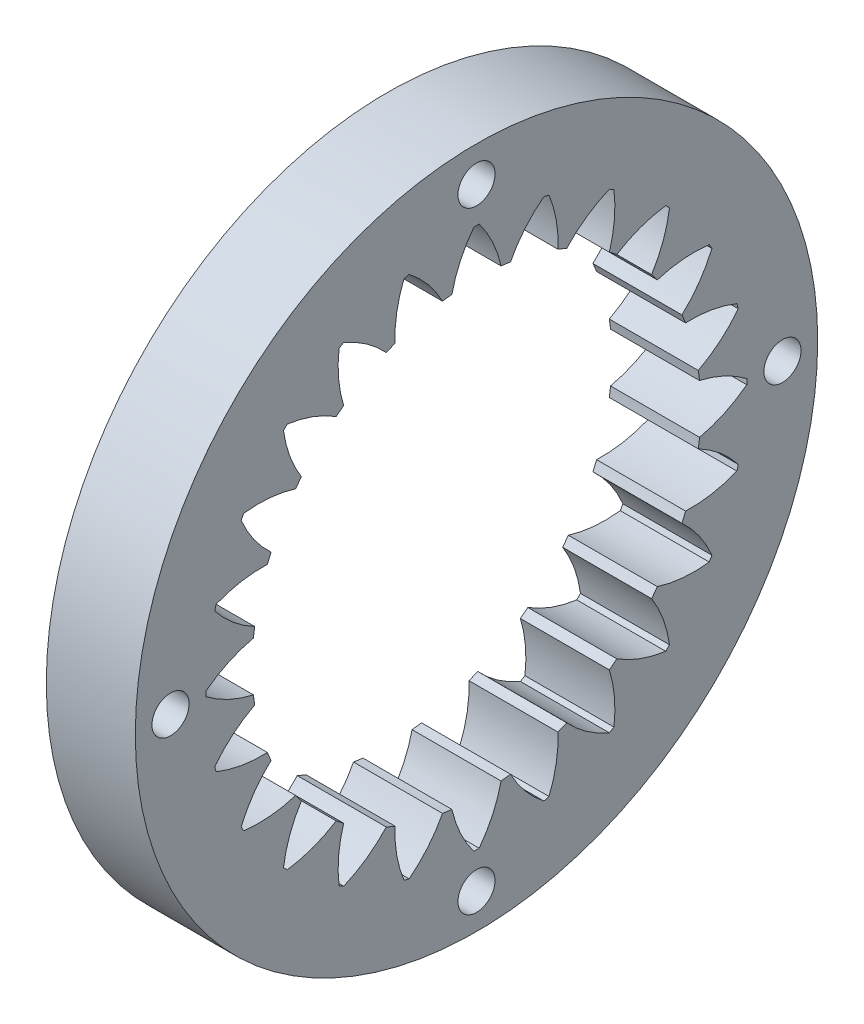
from build123d import *

# Parameters (mm, degrees)
BASPROSKE_W         = 12
BASPROSKE_H         = 6.2139
TOOTHCUT_DEPTH      = 53.945557004
TEETHCUTS_COUNT     = 24
TEETHCUTS_ANGLE     = 345
BOSS_EXTRUDE1_START = -12
SKETCH1_R           = 46
SKETCH1_R_2         = 36.4385
BOSS_EXTRUDE1_DEPTH = 12
SKETCH2_R           = 2.5
CUT_EXTRUDE1_DEPTH  = 12


with BuildPart() as part:
    # BasProSke → Base-Revolve (revolve)
    with BuildSketch(Plane(origin=(0, 0, 0), x_dir=(1, 0, 0), z_dir=(0, 1, 0)), mode=Mode.PRIVATE) as base_revolve_sk:
        with Locations((6, 33.35695)):
            Rectangle(BASPROSKE_W, BASPROSKE_H)
    revolve(base_revolve_sk.sketch.rotate(Axis((-10, 0, 0), (1, 0, 0)), 180), axis=Axis((-10, 0, 0), (1, 0, 0)))

    # TooCutSke → ToothCut (cut, through all)
    with BuildSketch(Plane(origin=(0, 0, 0), x_dir=(0, 0, -1), z_dir=(1, 0, 0))):
        with BuildLine():
            ThreePointArc((3.32012603, 30.041691169), (2.184951712, 33.399149944), (0.358959887, 36.436731879))
            ThreePointArc((0.358959887, 36.436731879), (0, 36.4385), (-0.358959887, 36.436731879))
            ThreePointArc((-0.358959887, 36.436731879), (-2.184951712, 33.399149944), (-3.32012603, 30.041691169))
            ThreePointArc((-3.32012603, 30.041691169), (0, 30.2246), (3.32012603, 30.041691169))
        make_face()
    toothcut = extrude(amount=TOOTHCUT_DEPTH, mode=Mode.SUBTRACT)

    # TeethCuts: ToothCut ×24 about axis
    teethcuts_axis = Axis((-10, 0, 0), (1, 0, 0))
    for i in range(1, TEETHCUTS_COUNT):
        add(toothcut.rotate(teethcuts_axis, i * TEETHCUTS_ANGLE / (TEETHCUTS_COUNT - 1)), mode=Mode.SUBTRACT)

    # Sketch1 → Boss-Extrude1 (add)
    with BuildSketch(Plane(origin=(12, 0, 0), x_dir=(0, 0, -1), z_dir=(1, 0, 0)).offset(BOSS_EXTRUDE1_START)):
        Circle(SKETCH1_R)
        Circle(SKETCH1_R_2, mode=Mode.SUBTRACT)
    extrude(amount=BOSS_EXTRUDE1_DEPTH)

    # Sketch2 → Cut-Extrude1 (cut)
    with BuildSketch(Plane(origin=(12, 0, 0), x_dir=(0, 0, -1), z_dir=(1, 0, 0))):
        with Locations((41.25, 0)):
            Circle(SKETCH2_R)
        with Locations((0, -41.25)):
            Circle(SKETCH2_R)
        with Locations((-41.25, 0)):
            Circle(SKETCH2_R)
        with Locations((0, 41.25)):
            Circle(SKETCH2_R)
    extrude(amount=-CUT_EXTRUDE1_DEPTH, mode=Mode.SUBTRACT)


solid = part.part
